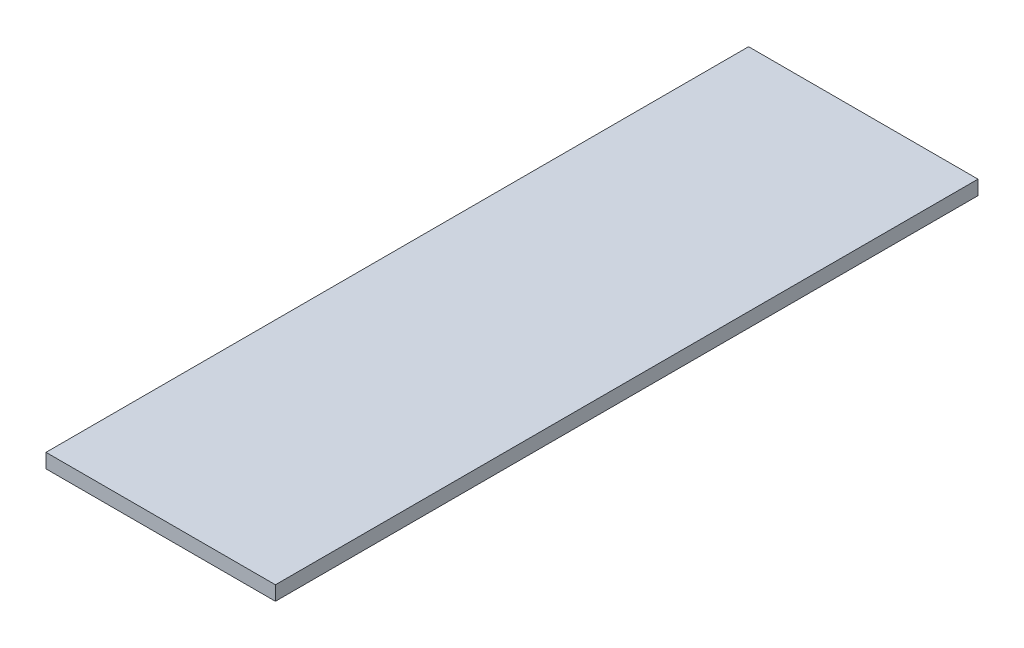
from build123d import *

# Parameters (mm, degrees)
SKETCH_1_W      = 2400
SKETCH_1_H      = 7350
EXTRUDE_1_DEPTH = 150


with BuildPart() as part:
    # Эскиз1 → Бобышка-Вытянуть1 (new body)
    with BuildSketch(Plane(origin=(0, 0, 0), x_dir=(1, 0, 0), z_dir=(0, 1, 0))):
        with Locations((0, -3375)):
            Rectangle(SKETCH_1_W, SKETCH_1_H)
    extrude(amount=-EXTRUDE_1_DEPTH)


solid = part.part
